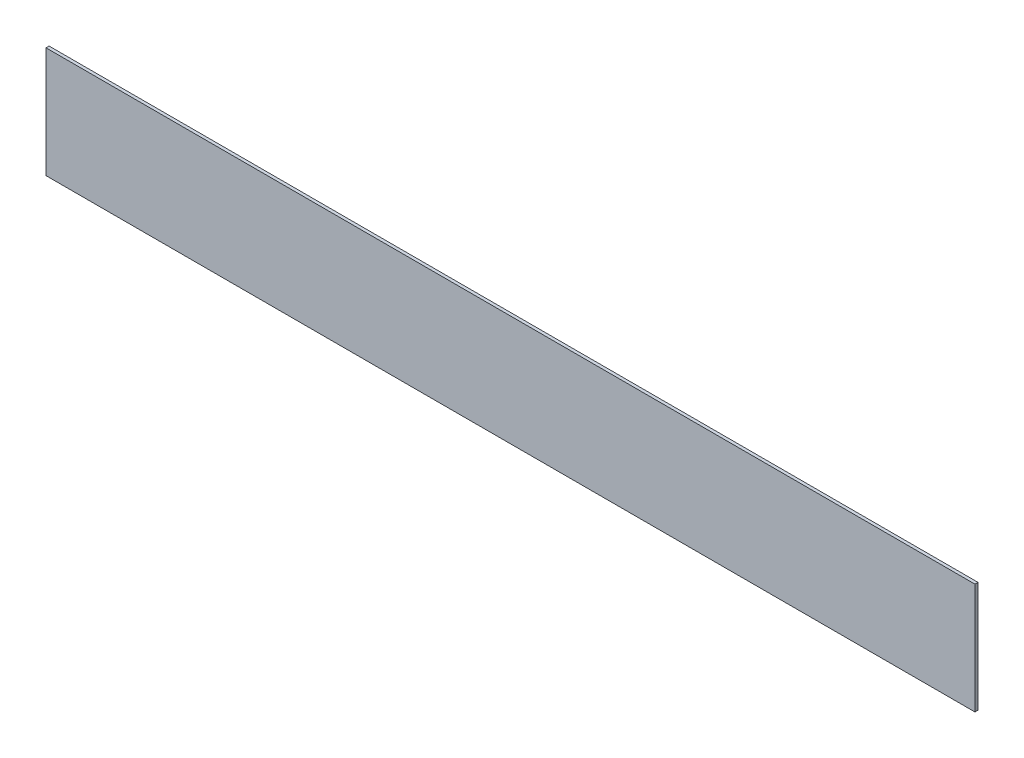
from build123d import *

# Parameters (mm, degrees)
CEK_ICECEK_KULP_CUKURU_1_0_1_START = 26
SKETCH1_W                          = 302
SKETCH1_H                          = 36
CEK_ICECEK_KULP_CUKURU_1_0_1_DEPTH = 1


with BuildPart() as part:
    # Sketch1 → CEK_icecek_kulp_cukuru_1.0_1 (new body)
    with BuildSketch(Plane.XY.offset(CEK_ICECEK_KULP_CUKURU_1_0_1_START)):
        with Locations((309, 75)):
            Rectangle(SKETCH1_W, SKETCH1_H)
    extrude(amount=CEK_ICECEK_KULP_CUKURU_1_0_1_DEPTH)


solid = part.part
